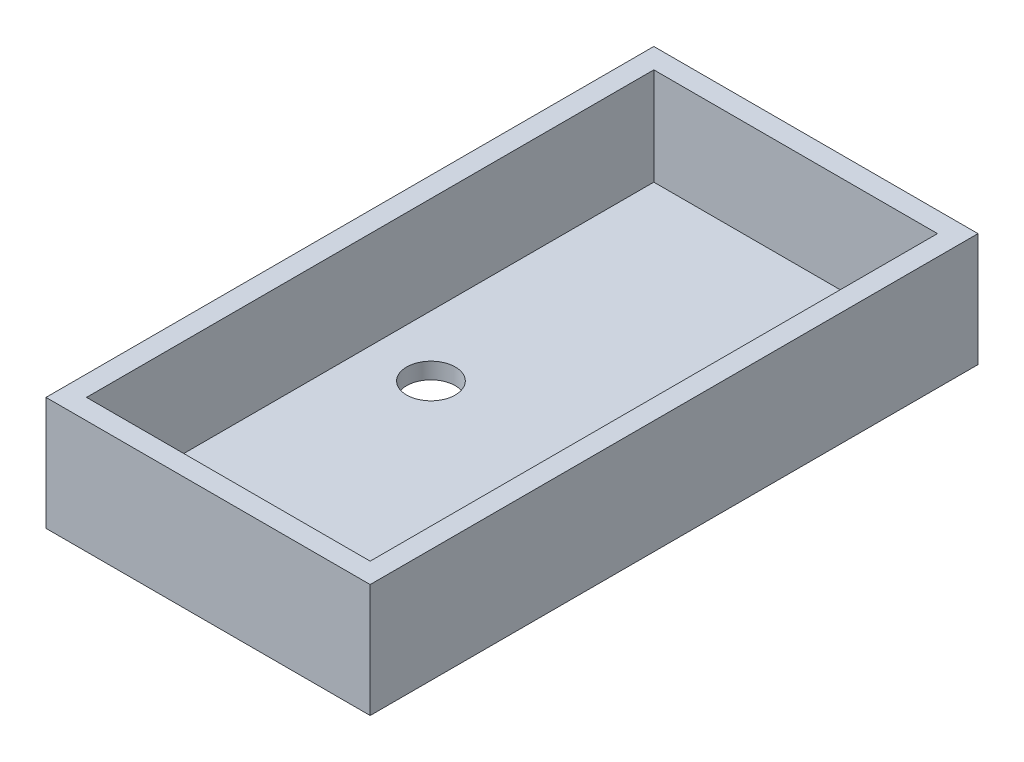
from build123d import *

# Parameters (mm, degrees)
SKETCH1_W           = 40
SKETCH1_H           = 75
SKETCH1_R           = 1.5
BOSS_EXTRUDE1_DEPTH = 14
SKETCH2_W           = 35
SKETCH2_H           = 70
CUT_EXTRUDE1_DEPTH  = 12
SKETCH3_R           = 3
CUT_EXTRUDE2_DEPTH  = 2


with BuildPart() as part:
    # Sketch1 → Boss-Extrude1 (new body)
    with BuildSketch(Plane(origin=(0, 0, 0), x_dir=(1, 0, 0), z_dir=(0, 1, 0))):
        Rectangle(SKETCH1_W, SKETCH1_H)
        with Locations(Location((-10, 0, 0), (0, 0, 270))):
            Circle(SKETCH1_R, mode=Mode.SUBTRACT)
        with Locations(Location((10, 0, 0), (0, 0, 270))):
            Circle(SKETCH1_R, mode=Mode.SUBTRACT)
    extrude(amount=BOSS_EXTRUDE1_DEPTH)

    # Sketch2 → Cut-Extrude1 (cut)
    with BuildSketch(Plane(origin=(0, 14, 0), x_dir=(1, 0, 0), z_dir=(0, 1, 0))):
        Rectangle(SKETCH2_W, SKETCH2_H)
    extrude(amount=-CUT_EXTRUDE1_DEPTH, mode=Mode.SUBTRACT)

    # Sketch3 → Cut-Extrude2 (cut)
    with BuildSketch(Plane(origin=(0, 2, 0), x_dir=(1, 0, 0), z_dir=(0, 1, 0))):
        with Locations(Location((-10, 0, 0), (0, 0, 270))):
            Circle(SKETCH3_R)
        with Locations(Location((10, 0, 0), (0, 0, 270))):
            Circle(SKETCH3_R)
    extrude(amount=-CUT_EXTRUDE2_DEPTH, mode=Mode.SUBTRACT)


solid = part.part
